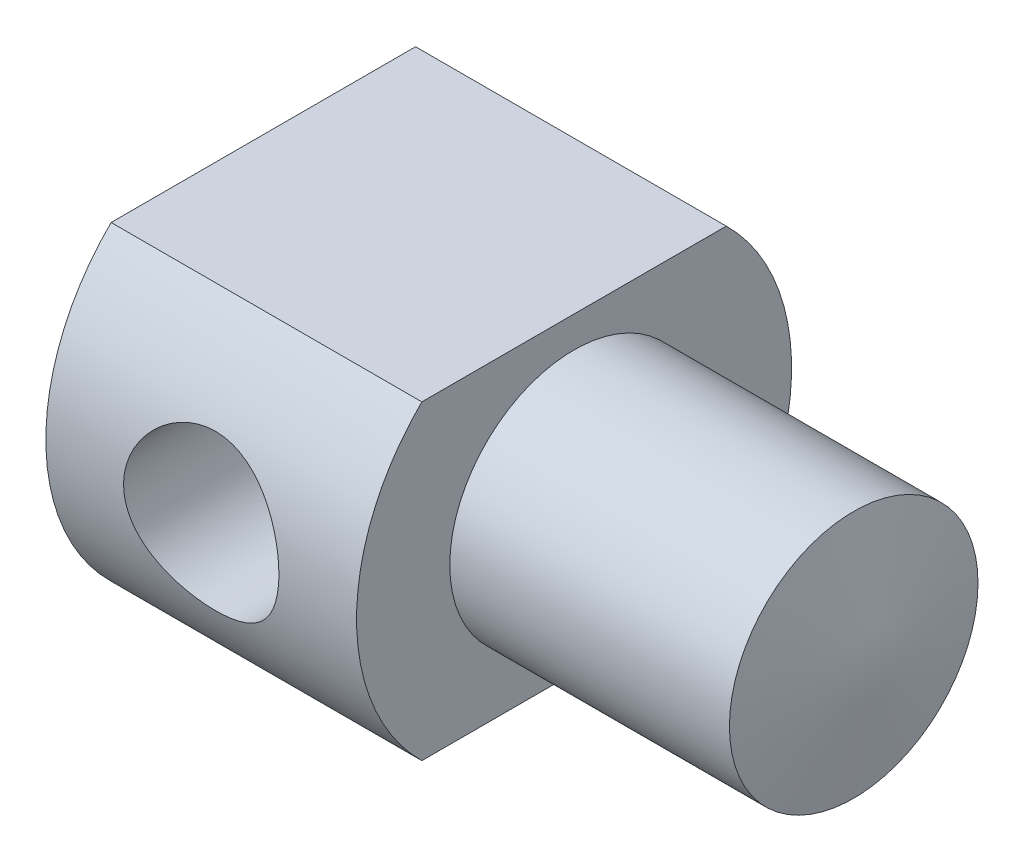
from build123d import *

# Parameters (mm, degrees)
SKETCH_2_R          = 2.5
SKETCH_2_W          = 14.617293851
SKETCH_2_H          = 4.056107718
CUT_EXTRUDE_1_DEPTH = 15


with BuildPart() as part:
    # Эскиз1 → Повернуть1 (revolve)
    with BuildSketch(Plane.XY, mode=Mode.PRIVATE) as revolve_1_sk:
        Polygon((0, 0), (-0.705307923, 4), (-9.705307923, 4), (-9.705307923, 7), (-19.705307923, 7), (-19.705307923, 0), align=None)
    revolve(revolve_1_sk.sketch.rotate(Axis((0, 0, 0), (-1, 0, 0)), 90), axis=Axis((0, 0, 0), (-1, 0, 0)))

    # Эскиз2 → Вырез-Вытянуть1 (cut, symmetric)
    with BuildSketch(Plane.XY):
        with Locations((-14.705307923, 0)):
            Circle(SKETCH_2_R)
        with Locations((-14.494430735, -7.028053859)):
            Rectangle(SKETCH_2_W, SKETCH_2_H)
        with Locations((-14.494430735, 7.028053859)):
            Rectangle(SKETCH_2_W, SKETCH_2_H)
    extrude(amount=CUT_EXTRUDE_1_DEPTH, both=True, mode=Mode.SUBTRACT)


solid = part.part
